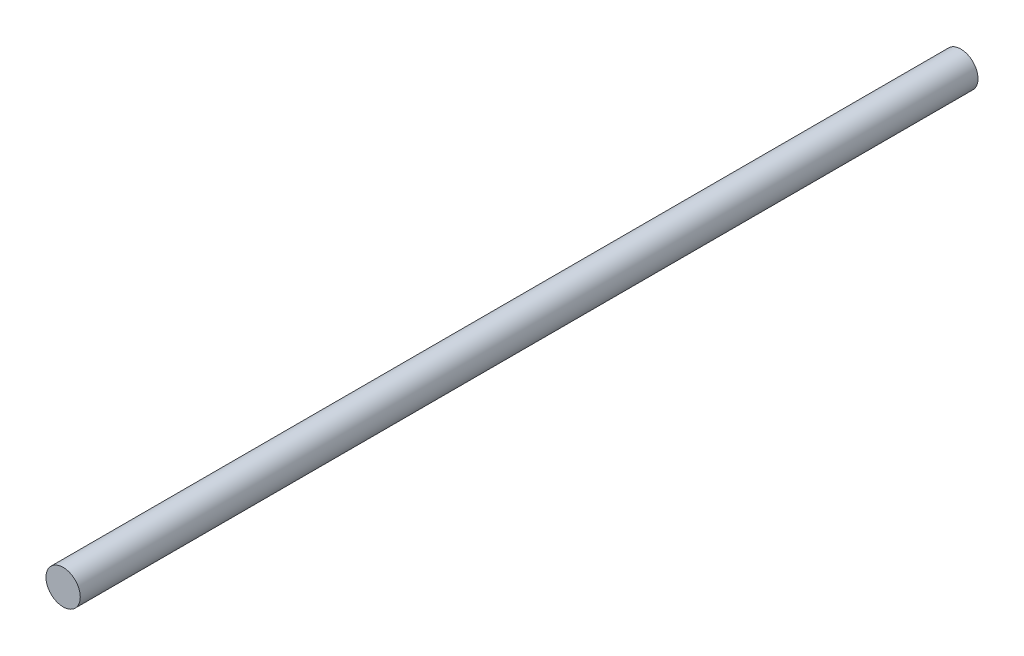
from build123d import *

# Parameters (mm, degrees)
SKETCH_1_R      = 3
EXTRUDE_1_DEPTH = 157


with BuildPart() as part:
    # 草图1 → 凸台-拉伸1 (new body)
    with BuildSketch(Plane.XY):
        Circle(SKETCH_1_R)
    extrude(amount=EXTRUDE_1_DEPTH)


solid = part.part
